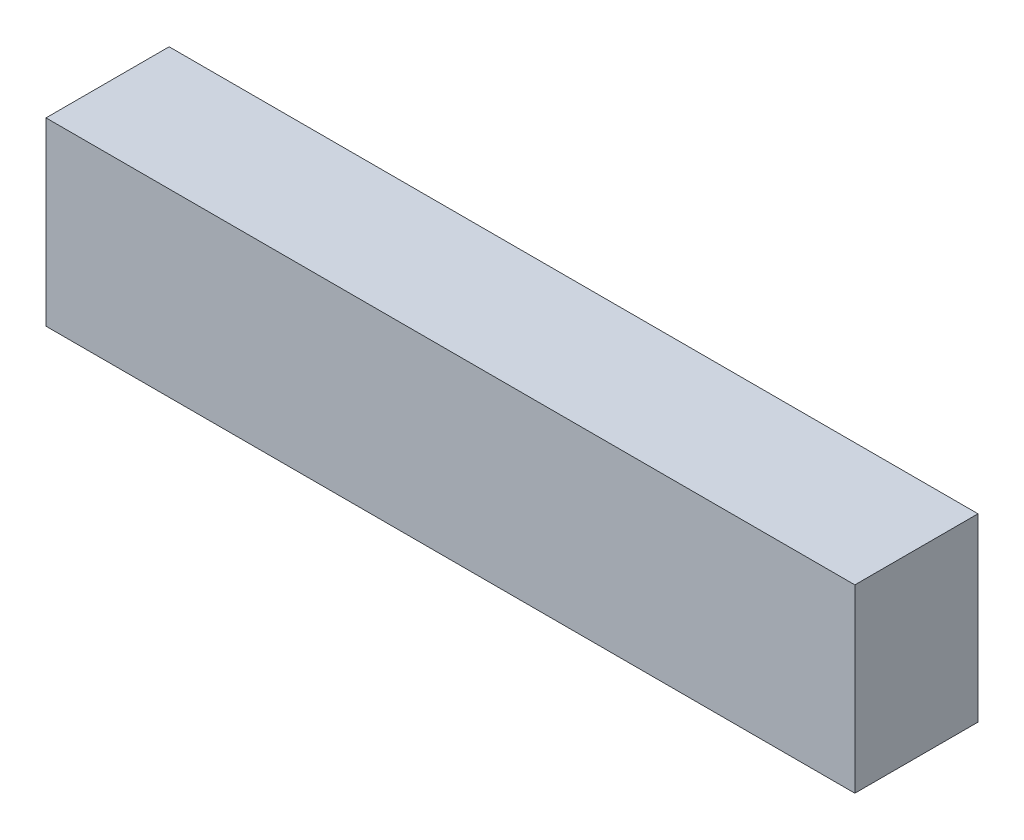
from build123d import *

# Parameters (mm, degrees)
SKETCH1_W           = 38.1
SKETCH1_H           = 5.8
BOSS_EXTRUDE1_DEPTH = 8.5


with BuildPart() as part:
    # Sketch1 → Boss-Extrude1 (new body)
    with BuildSketch(Plane(origin=(0, 0, 0), x_dir=(1, 0, 0), z_dir=(0, 1, 0))):
        Rectangle(SKETCH1_W, SKETCH1_H)
    extrude(amount=BOSS_EXTRUDE1_DEPTH)


solid = part.part
